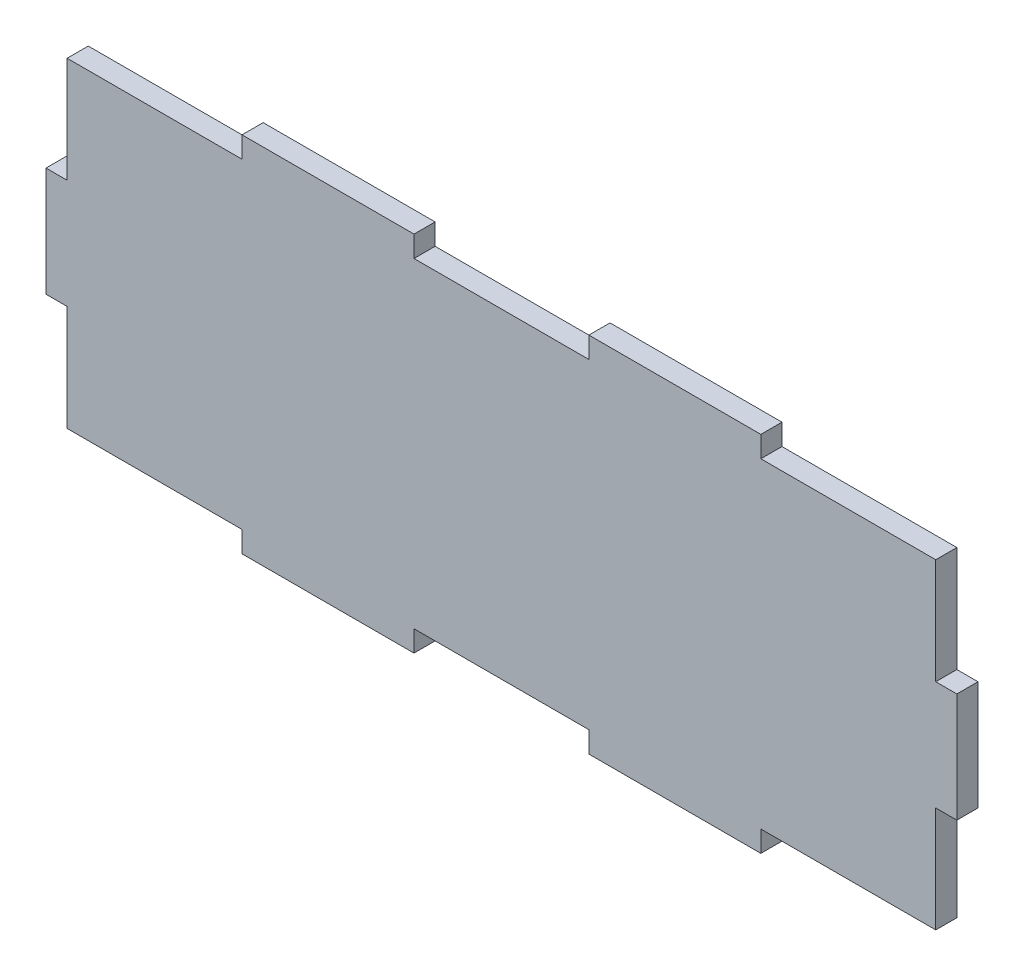
from build123d import *

# Parameters (mm, degrees)
SKETCH_1_W      = 238.4
SKETCH_1_H      = 88
EXTRUDE_1_DEPTH = 5.8
SKETCH_2_W      = 5.8
SKETCH_2_H      = 30
SKETCH_2_W_2    = 47.2
SKETCH_2_H_2    = 5.8
EXTRUDE_2_DEPTH = 5.8


with BuildPart() as part:
    # Эскиз1 → Бобышка-Вытянуть1 (new body)
    with BuildSketch(Plane.XY):
        with Locations((119.2, 44)):
            Rectangle(SKETCH_1_W, SKETCH_1_H)
    extrude(amount=EXTRUDE_1_DEPTH)

    # Эскиз2 → Бобышка-Вытянуть2 (add)
    with BuildSketch(Plane.XY.offset(5.8)):
        with Locations((-2.9, 44)):
            Rectangle(SKETCH_2_W, SKETCH_2_H)
        with Locations((241.3, 44)):
            Rectangle(SKETCH_2_W, SKETCH_2_H)
        with Locations((71.6, 90.9)):
            Rectangle(SKETCH_2_W_2, SKETCH_2_H_2)
        with Locations((166.8, 90.9)):
            Rectangle(SKETCH_2_W_2, SKETCH_2_H_2)
        with Locations((71.6, -2.9)):
            Rectangle(SKETCH_2_W_2, SKETCH_2_H_2)
        with Locations((166.8, -2.9)):
            Rectangle(SKETCH_2_W_2, SKETCH_2_H_2)
    extrude(amount=-EXTRUDE_2_DEPTH)


solid = part.part
